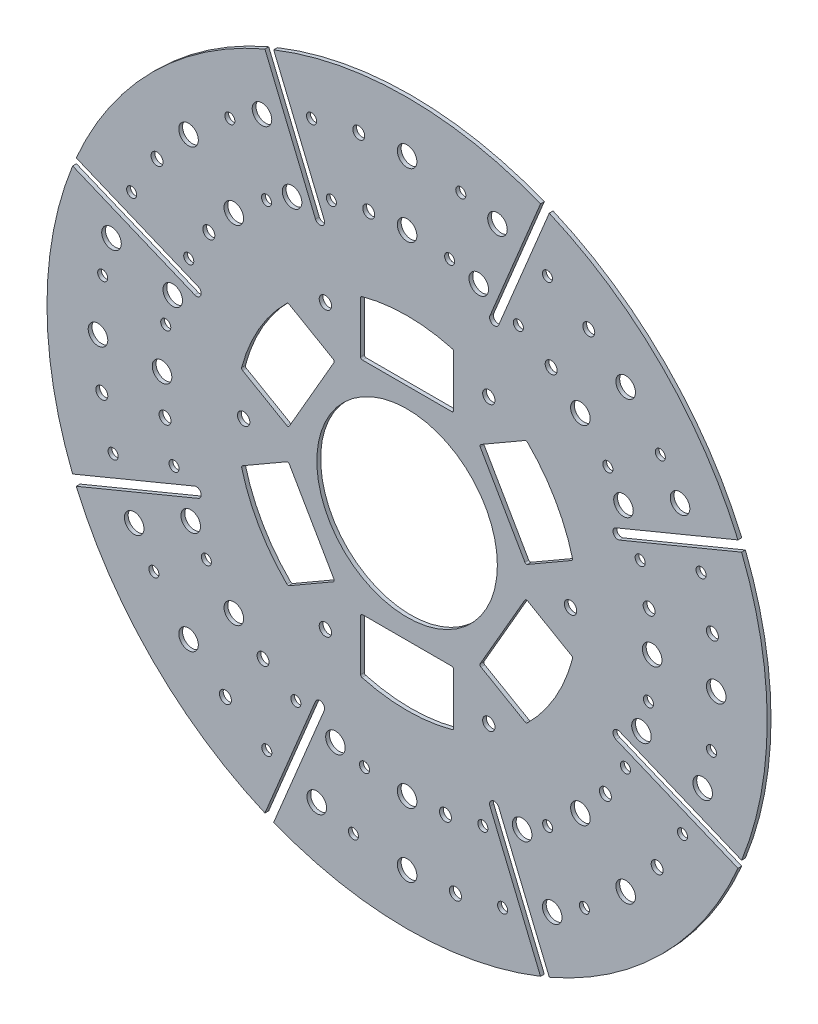
from build123d import *

# Parameters (mm, degrees)
ESBO_O1_R                = 189.5
ESBO_O1_R_2              = 47.5
RESSALTO_EXTRUS_O1_DEPTH = 2
CORTE_EXTRUS_O1_DEPTH    = 2
ESBO_O3_R                = 2.65
ESBO_O3_R_2              = 3.15
ESBO_O3_R_3              = 5.15
CORTE_EXTRUS_O2_DEPTH    = 2
CORTE_EXTRUS_O3_DEPTH    = 2
ESBO_O5_R                = 3.25
CORTE_EXTRUS_O4_DEPTH    = 2
FILETE1_R                = 1


with BuildPart() as part:
    # Esboço1 → Ressalto-extrusão1 (new body)
    with BuildSketch(Plane.XY):
        Circle(ESBO_O1_R)
        Circle(ESBO_O1_R_2, mode=Mode.SUBTRACT)
    extrude(amount=RESSALTO_EXTRUS_O1_DEPTH)

    # Esboço2 → Corte-extrusão1 (cut)
    with BuildSketch(Plane.XY.offset(2)):
        with BuildLine():
            Line((70.208811602, 176.031879992), (74.828209264, 174.11846283))
            Line((74.828209264, 174.11846283), (48.221743919, 109.884773346))
            ThreePointArc((48.221743919, 109.884773346), (44.955336507, 108.531783096), (43.602346257, 111.798190508))
            Line((43.602346257, 111.798190508), (70.208811602, 176.031879992))
        make_face()
        with BuildLine():
            Line((174.11846283, 74.828209264), (176.031879992, 70.208811602))
            Line((176.031879992, 70.208811602), (111.798190508, 43.602346257))
            ThreePointArc((111.798190508, 43.602346257), (108.531783096, 44.955336507), (109.884773346, 48.221743919))
            Line((109.884773346, 48.221743919), (174.11846283, 74.828209264))
        make_face()
        with BuildLine():
            Line((176.031879992, -70.208811602), (174.11846283, -74.828209264))
            Line((174.11846283, -74.828209264), (109.884773346, -48.221743919))
            ThreePointArc((109.884773346, -48.221743919), (108.531783096, -44.955336507), (111.798190508, -43.602346257))
            Line((111.798190508, -43.602346257), (176.031879992, -70.208811602))
        make_face()
        with BuildLine():
            Line((74.828209264, -174.11846283), (70.208811602, -176.031879992))
            Line((70.208811602, -176.031879992), (43.602346257, -111.798190508))
            ThreePointArc((43.602346257, -111.798190508), (44.955336507, -108.531783096), (48.221743919, -109.884773346))
            Line((48.221743919, -109.884773346), (74.828209264, -174.11846283))
        make_face()
        with BuildLine():
            Line((-70.208811602, -176.031879992), (-74.828209264, -174.11846283))
            Line((-74.828209264, -174.11846283), (-48.221743919, -109.884773346))
            ThreePointArc((-48.221743919, -109.884773346), (-44.955336507, -108.531783096), (-43.602346257, -111.798190508))
            Line((-43.602346257, -111.798190508), (-70.208811602, -176.031879992))
        make_face()
        with BuildLine():
            Line((-174.11846283, -74.828209264), (-176.031879992, -70.208811602))
            Line((-176.031879992, -70.208811602), (-111.798190508, -43.602346257))
            ThreePointArc((-111.798190508, -43.602346257), (-108.531783096, -44.955336507), (-109.884773346, -48.221743919))
            Line((-109.884773346, -48.221743919), (-174.11846283, -74.828209264))
        make_face()
        with BuildLine():
            Line((-176.031879992, 70.208811602), (-174.11846283, 74.828209264))
            Line((-174.11846283, 74.828209264), (-109.884773346, 48.221743919))
            ThreePointArc((-109.884773346, 48.221743919), (-108.531783096, 44.955336507), (-111.798190508, 43.602346257))
            Line((-111.798190508, 43.602346257), (-176.031879992, 70.208811602))
        make_face()
        with BuildLine():
            Line((-74.828209264, 174.11846283), (-70.208811602, 176.031879992))
            Line((-70.208811602, 176.031879992), (-43.602346257, 111.798190508))
            ThreePointArc((-43.602346257, 111.798190508), (-44.955336507, 108.531783096), (-48.221743919, 109.884773346))
            Line((-48.221743919, 109.884773346), (-74.828209264, 174.11846283))
        make_face()
    extrude(amount=-CORTE_EXTRUS_O1_DEPTH, mode=Mode.SUBTRACT)

    # Esboço3 → Corte-extrusão2 (cut)
    with BuildSketch(Plane.XY.offset(2)):
        with Locations((-50.263452432, 154.695000072)):
            Circle(ESBO_O3_R)
        with Locations((-25.444996345, 160.653384212)):
            Circle(ESBO_O3_R_2)
        with Locations((0, 162.655948855)):
            Circle(ESBO_O3_R_3)
        with Locations((28.244909105, 160.184839506)):
            Circle(ESBO_O3_R)
        with Locations((47.55599705, 155.548657475)):
            Circle(ESBO_O3_R_3)
        with Locations((37.703835745, 123.323689873)):
            Circle(ESBO_O3_R_3)
        with Locations((22.39341996, 126.999395496)):
            Circle(ESBO_O3_R)
        with Locations((0, 128.95856588)):
            Circle(ESBO_O3_R_3)
        with Locations((-20.173564266, 127.370871939)):
            Circle(ESBO_O3_R_2)
        with Locations((-39.850388427, 122.646884412)):
            Circle(ESBO_O3_R)
        with Locations((73.844255506, 144.927511628)):
            Circle(ESBO_O3_R)
        with Locations((95.606767934, 131.59142686)):
            Circle(ESBO_O3_R_2)
        with Locations((115.015124436, 115.015124436)):
            Circle(ESBO_O3_R_3)
        with Locations((133.23995302, 93.295619495)):
            Circle(ESBO_O3_R)
        with Locations((143.616678505, 76.362342505)):
            Circle(ESBO_O3_R_3)
        with Locations((113.863655322, 60.542379458)):
            Circle(ESBO_O3_R_3)
        with Locations((105.636672869, 73.967594654)):
            Circle(ESBO_O3_R)
        with Locations((91.187476426, 91.187476426)):
            Circle(ESBO_O3_R_3)
        with Locations((75.799943181, 104.329671367)):
            Circle(ESBO_O3_R_2)
        with Locations((58.54596377, 114.902923549)):
            Circle(ESBO_O3_R)
        with Locations((154.695000072, 50.263452432)):
            Circle(ESBO_O3_R)
        with Locations((160.653384212, 25.444996345)):
            Circle(ESBO_O3_R_2)
        with Locations((162.655948855, 0)):
            Circle(ESBO_O3_R_3)
        with Locations((160.184839506, -28.244909105)):
            Circle(ESBO_O3_R)
        with Locations((155.548657475, -47.55599705)):
            Circle(ESBO_O3_R_3)
        with Locations((123.323689873, -37.703835745)):
            Circle(ESBO_O3_R_3)
        with Locations((126.999395496, -22.39341996)):
            Circle(ESBO_O3_R)
        with Locations((128.95856588, 0)):
            Circle(ESBO_O3_R_3)
        with Locations((127.370871939, 20.173564266)):
            Circle(ESBO_O3_R_2)
        with Locations((122.646884412, 39.850388427)):
            Circle(ESBO_O3_R)
        with Locations((144.927511628, -73.844255506)):
            Circle(ESBO_O3_R)
        with Locations((131.59142686, -95.606767934)):
            Circle(ESBO_O3_R_2)
        with Locations((115.015124436, -115.015124436)):
            Circle(ESBO_O3_R_3)
        with Locations((93.295619495, -133.23995302)):
            Circle(ESBO_O3_R)
        with Locations((76.362342505, -143.616678505)):
            Circle(ESBO_O3_R_3)
        with Locations((60.542379458, -113.863655322)):
            Circle(ESBO_O3_R_3)
        with Locations((73.967594654, -105.636672869)):
            Circle(ESBO_O3_R)
        with Locations((91.187476426, -91.187476426)):
            Circle(ESBO_O3_R_3)
        with Locations((104.329671367, -75.799943181)):
            Circle(ESBO_O3_R_2)
        with Locations((114.902923549, -58.54596377)):
            Circle(ESBO_O3_R)
        with Locations((50.263452432, -154.695000072)):
            Circle(ESBO_O3_R)
        with Locations((25.444996345, -160.653384212)):
            Circle(ESBO_O3_R_2)
        with Locations((0, -162.655948855)):
            Circle(ESBO_O3_R_3)
        with Locations((-28.244909105, -160.184839506)):
            Circle(ESBO_O3_R)
        with Locations((-47.55599705, -155.548657475)):
            Circle(ESBO_O3_R_3)
        with Locations((-37.703835745, -123.323689873)):
            Circle(ESBO_O3_R_3)
        with Locations((-22.39341996, -126.999395496)):
            Circle(ESBO_O3_R)
        with Locations((0, -128.95856588)):
            Circle(ESBO_O3_R_3)
        with Locations((20.173564266, -127.370871939)):
            Circle(ESBO_O3_R_2)
        with Locations((39.850388427, -122.646884412)):
            Circle(ESBO_O3_R)
        with Locations((-73.844255506, -144.927511628)):
            Circle(ESBO_O3_R)
        with Locations((-95.606767934, -131.59142686)):
            Circle(ESBO_O3_R_2)
        with Locations((-115.015124436, -115.015124436)):
            Circle(ESBO_O3_R_3)
        with Locations((-133.23995302, -93.295619495)):
            Circle(ESBO_O3_R)
        with Locations((-143.616678505, -76.362342505)):
            Circle(ESBO_O3_R_3)
        with Locations((-113.863655322, -60.542379458)):
            Circle(ESBO_O3_R_3)
        with Locations((-105.636672869, -73.967594654)):
            Circle(ESBO_O3_R)
        with Locations((-91.187476426, -91.187476426)):
            Circle(ESBO_O3_R_3)
        with Locations((-75.799943181, -104.329671367)):
            Circle(ESBO_O3_R_2)
        with Locations((-58.54596377, -114.902923549)):
            Circle(ESBO_O3_R)
        with Locations((-154.695000072, -50.263452432)):
            Circle(ESBO_O3_R)
        with Locations((-160.653384212, -25.444996345)):
            Circle(ESBO_O3_R_2)
        with Locations((-162.655948855, 0)):
            Circle(ESBO_O3_R_3)
        with Locations((-160.184839506, 28.244909105)):
            Circle(ESBO_O3_R)
        with Locations((-155.548657475, 47.55599705)):
            Circle(ESBO_O3_R_3)
        with Locations((-123.323689873, 37.703835745)):
            Circle(ESBO_O3_R_3)
        with Locations((-126.999395496, 22.39341996)):
            Circle(ESBO_O3_R)
        with Locations((-128.95856588, 0)):
            Circle(ESBO_O3_R_3)
        with Locations((-127.370871939, -20.173564266)):
            Circle(ESBO_O3_R_2)
        with Locations((-122.646884412, -39.850388427)):
            Circle(ESBO_O3_R)
        with Locations((-144.927511628, 73.844255506)):
            Circle(ESBO_O3_R)
        with Locations((-131.59142686, 95.606767934)):
            Circle(ESBO_O3_R_2)
        with Locations((-115.015124436, 115.015124436)):
            Circle(ESBO_O3_R_3)
        with Locations((-93.295619495, 133.23995302)):
            Circle(ESBO_O3_R)
        with Locations((-76.362342505, 143.616678505)):
            Circle(ESBO_O3_R_3)
        with Locations((-60.542379458, 113.863655322)):
            Circle(ESBO_O3_R_3)
        with Locations((-73.967594654, 105.636672869)):
            Circle(ESBO_O3_R)
        with Locations((-91.187476426, 91.187476426)):
            Circle(ESBO_O3_R_3)
        with Locations((-104.329671367, 75.799943181)):
            Circle(ESBO_O3_R_2)
        with Locations((-114.902923549, 58.54596377)):
            Circle(ESBO_O3_R)
    extrude(amount=-CORTE_EXTRUS_O2_DEPTH, mode=Mode.SUBTRACT)

    # Esboço4 → Corte-extrusão3 (cut)
    with BuildSketch(Plane.XY.offset(2)):
        with BuildLine():
            Line((37.979473419, 50.217622393), (62.479473419, 7.782377607))
            Line((62.479473419, 7.782377607), (87.24874999, 22.082926103))
            ThreePointArc((87.24874999, 22.082926103), (77.942286341, 45), (62.74874999, 64.518170888))
            Line((62.74874999, 64.518170888), (37.979473419, 50.217622393))
        make_face()
        with BuildLine():
            Line((-24.5, 58), (24.5, 58))
            Line((24.5, 58), (24.5, 86.601096991))
            ThreePointArc((24.5, 86.601096991), (0, 90), (-24.5, 86.601096991))
            Line((-24.5, 86.601096991), (-24.5, 58))
        make_face()
        with BuildLine():
            Line((62.47947342, -7.782377607), (37.97947342, -50.217622393))
            Line((37.97947342, -50.217622393), (62.74874999, -64.518170888))
            ThreePointArc((62.74874999, -64.518170888), (77.942286341, -45), (87.24874999, -22.082926103))
            Line((87.24874999, -22.082926103), (62.47947342, -7.782377607))
        make_face()
        with BuildLine():
            Line((24.5, -58), (-24.5, -58))
            Line((-24.5, -58), (-24.5, -86.601096991))
            ThreePointArc((-24.5, -86.601096991), (0, -90), (24.5, -86.601096991))
            Line((24.5, -86.601096991), (24.5, -58))
        make_face()
        with BuildLine():
            Line((-37.979473419, -50.217622393), (-62.479473419, -7.782377607))
            Line((-62.479473419, -7.782377607), (-87.24874999, -22.082926103))
            ThreePointArc((-87.24874999, -22.082926103), (-77.942286341, -45), (-62.74874999, -64.518170888))
            Line((-62.74874999, -64.518170888), (-37.979473419, -50.217622393))
        make_face()
        with BuildLine():
            Line((-62.47947342, 7.782377607), (-37.97947342, 50.217622393))
            Line((-37.97947342, 50.217622393), (-62.74874999, 64.518170888))
            ThreePointArc((-62.74874999, 64.518170888), (-77.942286341, 45), (-87.24874999, 22.082926103))
            Line((-87.24874999, 22.082926103), (-62.47947342, 7.782377607))
        make_face()
    extrude(amount=-CORTE_EXTRUS_O3_DEPTH, mode=Mode.SUBTRACT)

    # Esboço5 → Corte-extrusão4 (cut)
    with BuildSketch(Plane.XY.offset(2)):
        with Locations((43, 74.478184725)):
            Circle(ESBO_O5_R)
        with Locations((86, 0)):
            Circle(ESBO_O5_R)
        with Locations((43, -74.478184725)):
            Circle(ESBO_O5_R)
        with Locations((-43, -74.478184725)):
            Circle(ESBO_O5_R)
        with Locations((-86, 0)):
            Circle(ESBO_O5_R)
        with Locations((-43, 74.478184725)):
            Circle(ESBO_O5_R)
    extrude(amount=-CORTE_EXTRUS_O4_DEPTH, mode=Mode.SUBTRACT)

    # Filete1
    filete1_edges = [part.edges().sort_by_distance(p)[0] for p in [
        (37.979473419, 50.217622393, 1),
        (62.74874999, 64.518170888, 1),
        (87.24874999, 22.082926103, 1),
        (62.479473419, 7.782377607, 1),
        (-24.5, 58, 1),
        (-24.5, 86.601096991, 1),
        (24.5, 86.601096991, 1),
        (24.5, 58, 1),
        (62.47947342, -7.782377607, 1),
        (87.24874999, -22.082926103, 1),
        (62.74874999, -64.518170888, 1),
        (37.97947342, -50.217622393, 1),
        (24.5, -58, 1),
        (24.5, -86.601096991, 1),
        (-24.5, -86.601096991, 1),
        (-24.5, -58, 1),
        (-37.979473419, -50.217622393, 1),
        (-62.74874999, -64.518170888, 1),
        (-87.24874999, -22.082926103, 1),
        (-62.479473419, -7.782377607, 1),
        (-62.47947342, 7.782377607, 1),
        (-87.24874999, 22.082926103, 1),
        (-62.74874999, 64.518170888, 1),
        (-37.97947342, 50.217622393, 1),
    ]]
    fillet(filete1_edges, radius=FILETE1_R)


solid = part.part
